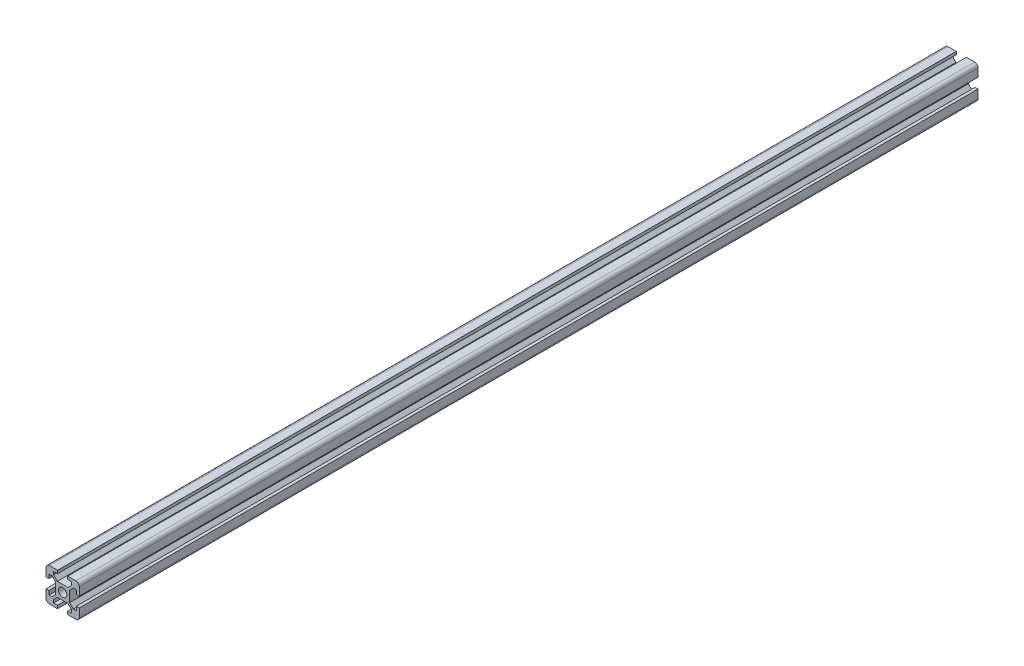
from build123d import *

# Parameters (mm, degrees)
SKETCH1_R           = 2.5
BOSS_EXTRUDE1_DEPTH = 540
FILLET1_R           = 2


with BuildPart() as part:
    # Sketch1 → Boss-Extrude1 (new body)
    with BuildSketch(Plane.XY):
        Polygon((-5.46, -6.42), (-3.215, -4.175), (3.215, -4.175), (5.46, -6.42), (5.46, -8.22), (3.06, -8.22), (3.06, -10), (10, -10), (10, -3.06), (8.22, -3.06), (8.22, -5.46), (6.42, -5.46), (4.175, -3.215), (4.175, 3.215), (6.42, 5.46), (8.22, 5.46), (8.22, 3.06), (10, 3.06), (10, 10), (3.06, 10), (3.06, 8.22), (5.46, 8.22), (5.46, 6.42), (3.215, 4.175), (-3.215, 4.175), (-5.46, 6.42), (-5.46, 8.22), (-3.06, 8.22), (-3.06, 10), (-10, 10), (-10, 3.06), (-8.22, 3.06), (-8.22, 5.46), (-6.42, 5.46), (-4.175, 3.215), (-4.175, -3.215), (-6.42, -5.46), (-8.22, -5.46), (-8.22, -3.06), (-10, -3.06), (-10, -10), (-3.06, -10), (-3.06, -8.22), (-5.46, -8.22), align=None)
        Circle(SKETCH1_R, mode=Mode.SUBTRACT)
    extrude(amount=BOSS_EXTRUDE1_DEPTH)

    # Fillet1
    fillet1_edges = [part.edges().sort_by_distance(p)[0] for p in [
        (10, -10, 270),
        (-10, -10, 270),
        (-10, 10, 270),
        (10, 10, 270),
    ]]
    fillet(fillet1_edges, radius=FILLET1_R)


solid = part.part
